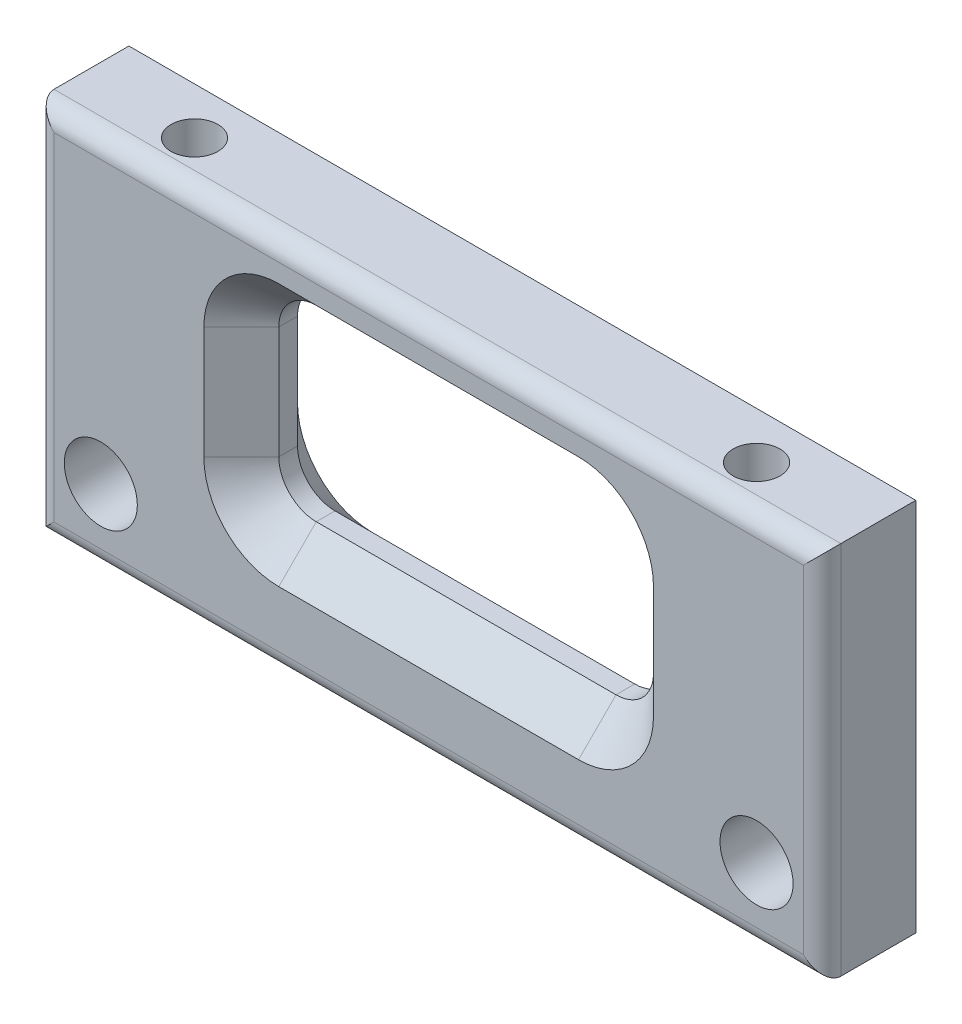
from build123d import *

# Parameters (mm, degrees)
SKETCH1_W           = 42
SKETCH1_H           = 20
SKETCH1_R           = 1.95
BOSS_EXTRUDE1_DEPTH = 5
SKETCH2_R           = 1.25
CUT_EXTRUDE1_DEPTH  = 10
CUT_EXTRUDE2_DEPTH  = 10
FILLET1_R           = 1
CHAMFER1_SIZE       = 2


with BuildPart() as part:
    # Sketch1 → Boss-Extrude1 (new body)
    with BuildSketch(Plane.XY):
        with Locations((21, -10)):
            Rectangle(SKETCH1_W, SKETCH1_H)
        with Locations((38.5, -16)):
            Circle(SKETCH1_R, mode=Mode.SUBTRACT)
        with Locations((3.5, -16)):
            Circle(SKETCH1_R, mode=Mode.SUBTRACT)
    extrude(amount=BOSS_EXTRUDE1_DEPTH)

    # Sketch2 → Cut-Extrude1 (cut)
    with BuildSketch(Plane(origin=(0, 0, 0), x_dir=(1, 0, 0), z_dir=(0, 1, 0))):
        with Locations(Location((36, -2.5, 0), (0, 0, 270))):
            Circle(SKETCH2_R)
        with Locations(Location((6, -2.5, 0), (0, 0, 270))):
            Circle(SKETCH2_R)
    extrude(amount=-CUT_EXTRUDE1_DEPTH, mode=Mode.SUBTRACT)

    # Sketch3 → Cut-Extrude2 (cut)
    with BuildSketch(Plane.XY.offset(5)):
        with BuildLine():
            Line((29, -13.990346174), (13, -13.990346174))
            ThreePointArc((13, -13.990346174), (11.585786438, -13.404559737), (11, -11.990346174))
            Line((11, -11.990346174), (11, -5.990346174))
            ThreePointArc((11, -5.990346174), (11.585786438, -4.576132612), (13, -3.990346174))
            Line((13, -3.990346174), (29, -3.990346174))
            ThreePointArc((29, -3.990346174), (30.414213562, -4.576132612), (31, -5.990346174))
            Line((31, -5.990346174), (31, -11.990346174))
            ThreePointArc((31, -11.990346174), (30.414213562, -13.404559737), (29, -13.990346174))
        make_face()
    extrude(amount=-CUT_EXTRUDE2_DEPTH, mode=Mode.SUBTRACT)

    # Fillet1
    fillet1_edges = [part.edges().sort_by_distance(p)[0] for p in [
        (42, -10, 5),
        (21, 0, 5),
        (0, -10, 5),
        (21, -20, 5),
    ]]
    fillet(fillet1_edges, radius=FILLET1_R)

    # Chamfer1
    chamfer1_edges = [part.edges().sort_by_distance(p)[0] for p in [
        (21, -13.990346174, 0),
        (30.414213562, -13.404559737, 0),
        (31, -8.990346174, 0),
        (30.414213562, -4.576132612, 0),
        (21, -3.990346174, 0),
        (11.585786438, -4.576132612, 0),
        (11, -8.990346174, 0),
        (11.585786438, -13.404559737, 0),
        (11.585786438, -13.404559737, 5),
        (21, -13.990346174, 5),
        (30.414213562, -13.404559737, 5),
        (31, -8.990346174, 5),
        (30.414213562, -4.576132612, 5),
        (21, -3.990346174, 5),
        (11.585786438, -4.576132612, 5),
        (11, -8.990346174, 5),
    ]]
    chamfer(chamfer1_edges, length=CHAMFER1_SIZE)


solid = part.part
